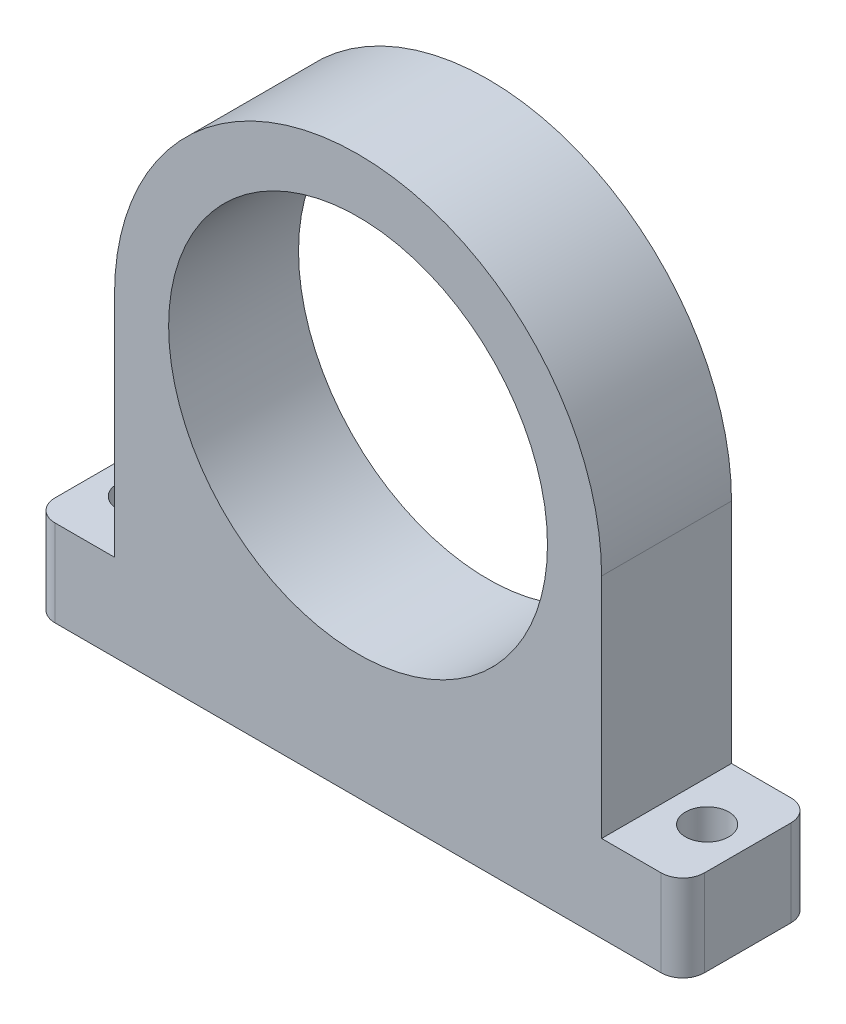
from build123d import *

# Parameters (mm, degrees)
CROQUIS1_R              = 17.5
SALIENTE_EXTRUIR1_DEPTH = 6
CROQUIS2_R              = 2
CORTAR_EXTRUIR1_DEPTH   = 54.181293704
REDONDEO1_R             = 2


with BuildPart() as part:
    # Croquis1 → Saliente-Extruir1 (new, symmetric)
    with BuildSketch(Plane.XY):
        with BuildLine():
            Line((30, 0), (-30, 0))
            Line((-30, 0), (-30, 8))
            Line((-30, 8), (-22.5, 8))
            Line((-22.5, 8), (-22.5, 29))
            ThreePointArc((-22.5, 29), (0, 51.5), (22.5, 29))
            Line((22.5, 29), (22.5, 8))
            Line((22.5, 8), (30, 8))
            Line((30, 8), (30, 0))
        make_face()
        with Locations((0, 29)):
            Circle(CROQUIS1_R, mode=Mode.SUBTRACT)
    extrude(amount=SALIENTE_EXTRUIR1_DEPTH, both=True)

    # Croquis2 → Cortar-Extruir1 (cut, through all)
    with BuildSketch(Plane(origin=(0, 8, 0), x_dir=(1, 0, 0), z_dir=(0, 1, 0))):
        with Locations(Location((-26.25, 0, 0), (0, 0, 270))):
            Circle(CROQUIS2_R)
        with Locations(Location((26.25, 0, 0), (0, 0, 90))):
            Circle(CROQUIS2_R)
    extrude(amount=-CORTAR_EXTRUIR1_DEPTH, mode=Mode.SUBTRACT)

    # Redondeo1
    redondeo1_edges = [part.edges().sort_by_distance(p)[0] for p in [
        (30, 4, 6),
        (-30, 4, -6),
        (-30, 4, 6),
        (30, 4, -6),
    ]]
    fillet(redondeo1_edges, radius=REDONDEO1_R)


solid = part.part
